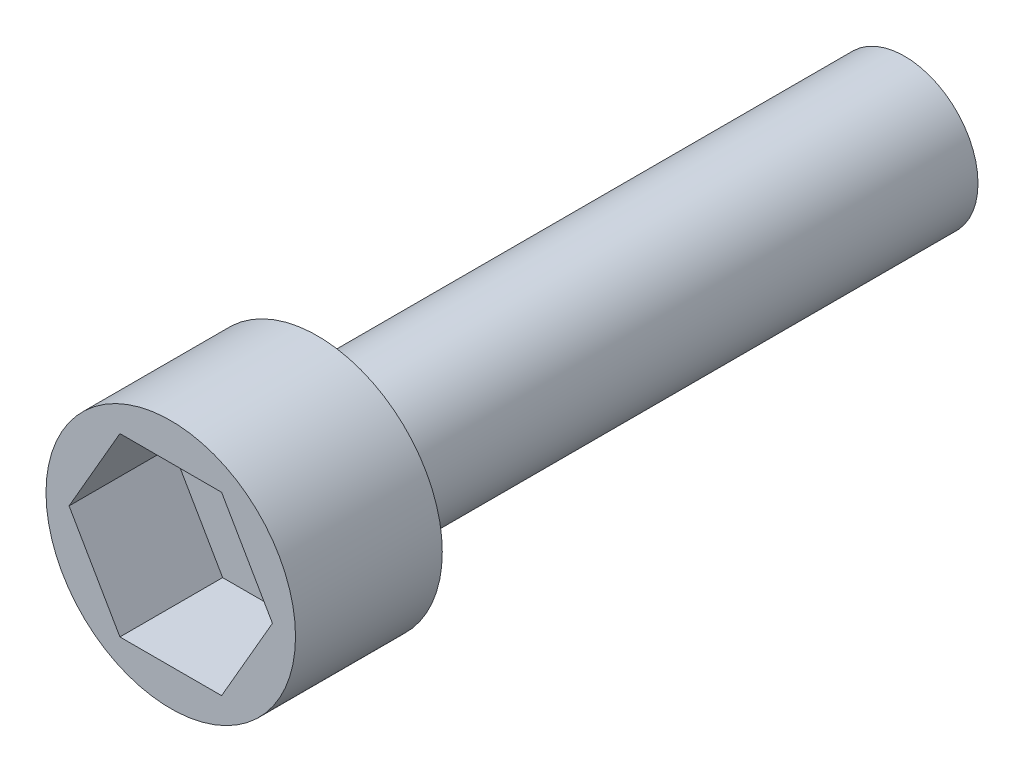
from build123d import *

# Parameters (mm, degrees)
ESQUISSE1_R             = 2.5
BOSS_EXTRU_1_DEPTH      = 20
ESQUISSE2_R             = 4.25
BOSS_EXTRU_2_DEPTH      = 5
ENL_V_MAT_EXTRU_1_DEPTH = 3.5


with BuildPart() as part:
    # Esquisse1 → Boss.-Extru.1 (new body)
    with BuildSketch(Plane.XY):
        Circle(ESQUISSE1_R)
    extrude(amount=BOSS_EXTRU_1_DEPTH)

    # Esquisse2 → Boss.-Extru.2 (add)
    with BuildSketch(Plane.XY.offset(20)):
        Circle(ESQUISSE2_R)
    extrude(amount=BOSS_EXTRU_2_DEPTH)

    # Esquisse3 → Enlèv. mat.-Extru.1 (cut)
    with BuildSketch(Plane.XY.offset(25)):
        Polygon((3.464101615, 0), (1.732050808, 3), (-1.732050808, 3), (-3.464101615, 0), (-1.732050808, -3), (1.732050808, -3), align=None)
    extrude(amount=-ENL_V_MAT_EXTRU_1_DEPTH, mode=Mode.SUBTRACT)


solid = part.part
